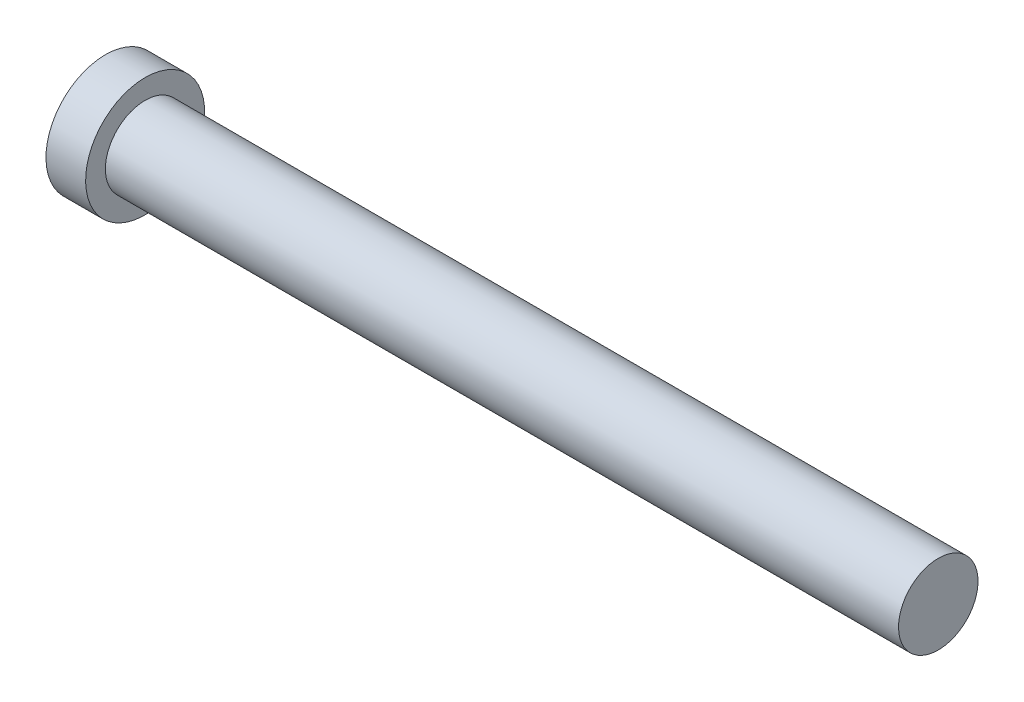
from build123d import *


with BuildPart() as part:
    # Sketch1 → Revolve1 (revolve)
    with BuildSketch(Plane.XY):
        Polygon((133.35, 0), (0, 0), (0, 9.525), (6.35, 9.525), (6.35, 6.3627), (133.35, 6.3627), align=None)
    revolve(axis=Axis((133.35, 0, 0), (-1, 0, 0)))


solid = part.part
